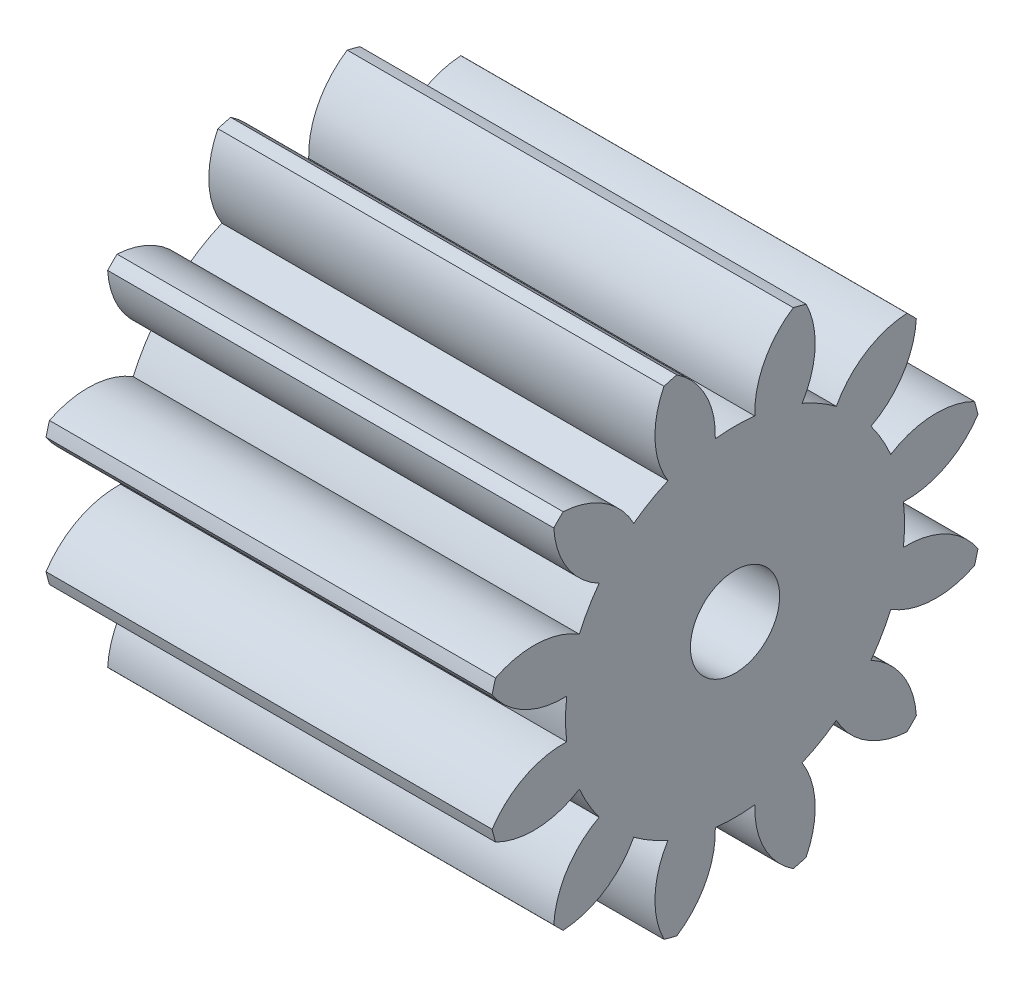
from build123d import *

# Parameters (mm, degrees)
BASPROSKE_W     = 100
BASPROSKE_H     = 56
TOOTHCUT_DEPTH  = 128.561749753
TEETHCUTS_COUNT = 12
BORSKE_R        = 10
BORE_DEPTH      = 100.0000508


with BuildPart() as part:
    # BasProSke → Base-Revolve (revolve)
    with BuildSketch(Plane(origin=(0, 0, 0), x_dir=(1, 0, 0), z_dir=(0, 1, 0)), mode=Mode.PRIVATE) as base_revolve_sk:
        with Locations((50, 28)):
            Rectangle(BASPROSKE_W, BASPROSKE_H)
    revolve(base_revolve_sk.sketch.rotate(Axis((-10, 0, 0), (1, 0, 0)), 180), axis=Axis((-10, 0, 0), (1, 0, 0)))

    # TooCutSke → ToothCut (cut, through all)
    with BuildSketch(Plane(origin=(0, 0, 0), x_dir=(0, 0, -1), z_dir=(1, 0, 0))):
        with BuildLine():
            ThreePointArc((4.429508858, 37.739945049), (0, 37.999), (-4.429508858, 37.739945049))
            ThreePointArc((-4.429508858, 37.739945049), (-6.560078122, 47.242513828), (-13.078840191, 54.477420868))
            ThreePointArc((-13.078840191, 54.477420868), (0, 56.0254), (13.078840191, 54.477420868))
            ThreePointArc((13.078840191, 54.477420868), (6.560078122, 47.242513828), (4.429508858, 37.739945049))
        make_face()
    toothcut = extrude(amount=TOOTHCUT_DEPTH, mode=Mode.SUBTRACT)

    # TeethCuts: ToothCut ×12 about axis
    teethcuts_axis = Axis((0, 0, 0), (1, 0, 0))
    for i in range(1, TEETHCUTS_COUNT):
        add(toothcut.rotate(teethcuts_axis, i * 360 / TEETHCUTS_COUNT), mode=Mode.SUBTRACT)

    # BorSke → Bore (cut, symmetric)
    with BuildSketch(Plane(origin=(0, 0, 0), x_dir=(0, 0, -1), z_dir=(1, 0, 0))):
        with Locations(Location((0, 0, 0), (0, 0, 180))):
            Circle(BORSKE_R)
    extrude(amount=BORE_DEPTH, both=True, mode=Mode.SUBTRACT)


solid = part.part
